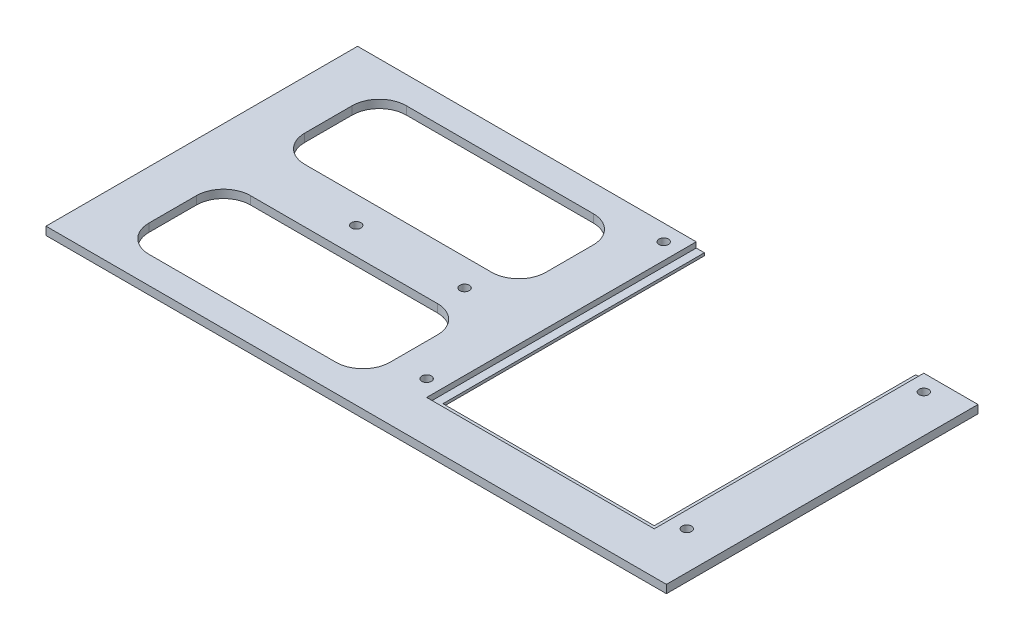
from build123d import *

# Parameters (mm, degrees)
SKETCH_1_W          = 229
SKETCH_1_H          = 115
EXTRUDE_1_DEPTH     = 3
SKETCH_2_W          = 84
SKETCH_2_H          = 99.5
CUT_EXTRUDE_2_DEPTH = 2
SKETCH_4_W          = 78
SKETCH_4_H          = 96.5
CUT_EXTRUDE_3_DEPTH = 2
SKETCH_5_R          = 1.75
CUT_EXTRUDE_4_DEPTH = 3


with BuildPart() as part:
    # 草图1 → 凸台-拉伸1 (new body)
    with BuildSketch(Plane(origin=(0, 0, 0), x_dir=(1, 0, 0), z_dir=(0, 1, 0))):
        with Locations((-7.184913218, 3.036715621)):
            Rectangle(SKETCH_1_W, SKETCH_1_H)
    extrude(amount=EXTRUDE_1_DEPTH)

    # 草图2 → 切除-拉伸2 (cut)
    with BuildSketch(Plane(origin=(0, 3, 0), x_dir=(1, 0, 0), z_dir=(0, 1, 0))):
        with Locations((45.315086782, 10.786715621)):
            Rectangle(SKETCH_2_W, SKETCH_2_H)
    extrude(amount=-CUT_EXTRUDE_2_DEPTH, mode=Mode.SUBTRACT)

    # 草图4 → 切除-拉伸3 (cut)
    with BuildSketch(Plane(origin=(0, 1, 0), x_dir=(1, 0, 0), z_dir=(0, 1, 0))):
        with Locations((45.315086782, 12.286715621)):
            Rectangle(SKETCH_4_W, SKETCH_4_H)
    extrude(amount=-CUT_EXTRUDE_3_DEPTH, mode=Mode.SUBTRACT)

    # 草图5 → 切除-拉伸4 (cut)
    with BuildSketch(Plane(origin=(0, 3, 0), x_dir=(1, 0, 0), z_dir=(0, 1, 0))):
        with Locations(Location((-64.684913218, 3.036715621, 0), (0, 0, 270))):
            Circle(SKETCH_5_R)
        with Locations(Location((-24.684913218, 3.036715621, 0), (0, 0, 270))):
            Circle(SKETCH_5_R)
        with Locations(Location((-2.684913218, 54.536715621, 0), (0, 0, 270))):
            Circle(SKETCH_5_R)
        with Locations(Location((93.315086782, 54.536715621, 0), (0, 0, 270))):
            Circle(SKETCH_5_R)
        with Locations(Location((93.315086782, -32.963284379, 0), (0, 0, 270))):
            Circle(SKETCH_5_R)
        with Locations(Location((-2.684913218, -32.963284379, 0), (0, 0, 270))):
            Circle(SKETCH_5_R)
        with BuildLine():
            Line((-93.684913218, 50.536715621), (-24.684913218, 50.536715621))
            ThreePointArc((-24.684913218, 50.536715621), (-17.613845406, 47.607783433), (-14.684913218, 40.536715621))
            Line((-14.684913218, 40.536715621), (-14.684913218, 23.036715621))
            ThreePointArc((-14.684913218, 23.036715621), (-17.613845406, 15.965647809), (-24.684913218, 13.036715621))
            Line((-24.684913218, 13.036715621), (-93.684913218, 13.036715621))
            ThreePointArc((-93.684913218, 13.036715621), (-100.755981029, 15.965647809), (-103.684913218, 23.036715621))
            Line((-103.684913218, 23.036715621), (-103.684913218, 40.536715621))
            ThreePointArc((-103.684913218, 40.536715621), (-100.755981029, 47.607783433), (-93.684913218, 50.536715621))
        make_face()
        with BuildLine():
            Line((-93.684913218, -6.963284379), (-24.684913218, -6.963284379))
            ThreePointArc((-24.684913218, -6.963284379), (-17.613845406, -9.892216567), (-14.684913218, -16.963284379))
            Line((-14.684913218, -16.963284379), (-14.684913218, -34.463284379))
            ThreePointArc((-14.684913218, -34.463284379), (-17.613845406, -41.534352191), (-24.684913218, -44.463284379))
            Line((-24.684913218, -44.463284379), (-93.684913218, -44.463284379))
            ThreePointArc((-93.684913218, -44.463284379), (-100.755981029, -41.534352191), (-103.684913218, -34.463284379))
            Line((-103.684913218, -34.463284379), (-103.684913218, -16.963284379))
            ThreePointArc((-103.684913218, -16.963284379), (-100.755981029, -9.892216567), (-93.684913218, -6.963284379))
        make_face()
    extrude(amount=-CUT_EXTRUDE_4_DEPTH, mode=Mode.SUBTRACT)


solid = part.part
